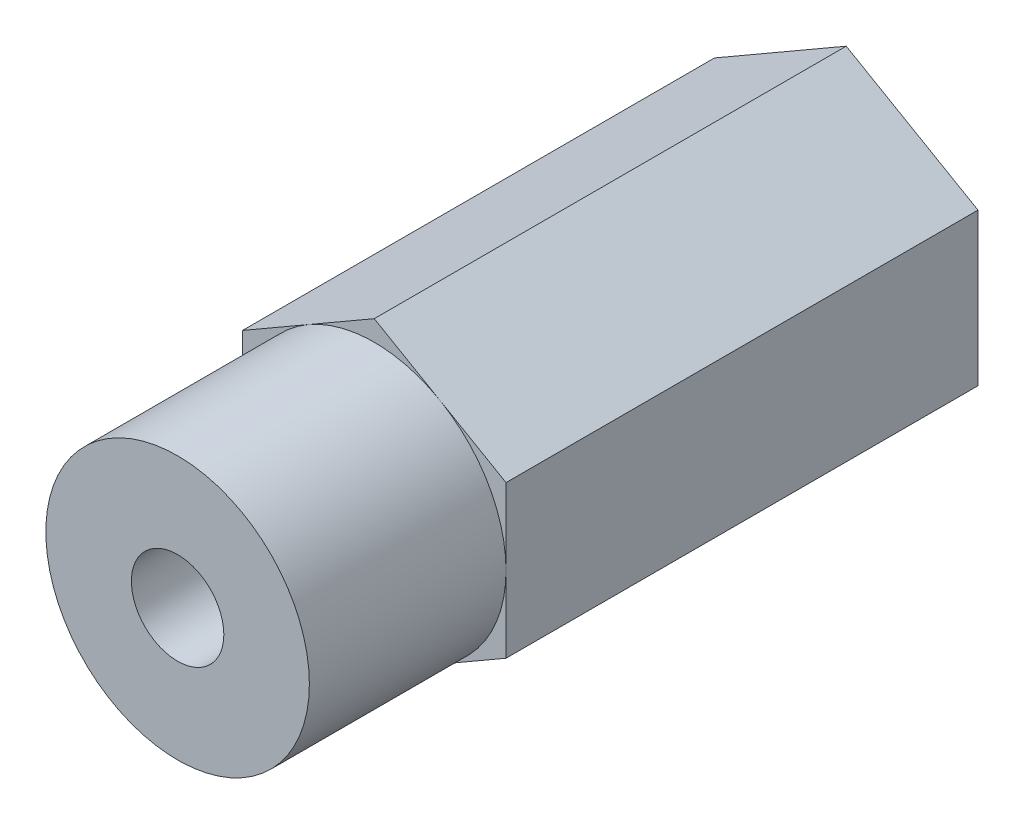
from build123d import *

# Parameters (mm, degrees)
BOSS_EXTRUDE1_DEPTH = 10.2
SKETCH2_R           = 2.320948082
SKETCH2_R_2         = 2.01
CUT_EXTRUDE2_DEPTH  = 3
SKETCH4_R           = 0.705
CUT_EXTRUDE3_DEPTH  = 7


with BuildPart() as part:
    # Sketch1 → Boss-Extrude1 (new body)
    with BuildSketch(Plane.XY):
        Polygon((0, -2.320948082), (2.01, -1.160474041), (2.01, 1.160474041), (0, 2.320948082), (-2.01, 1.160474041), (-2.01, -1.160474041), align=None)
    extrude(amount=BOSS_EXTRUDE1_DEPTH)

    # Sketch2 → Cut-Extrude2 (cut)
    with BuildSketch(Plane.XY.offset(10.2)):
        Circle(SKETCH2_R)
        Circle(SKETCH2_R_2, mode=Mode.SUBTRACT)
    extrude(amount=-CUT_EXTRUDE2_DEPTH, mode=Mode.SUBTRACT)

    # Sketch4 → Cut-Extrude3 (cut)
    with BuildSketch(Plane.XY.offset(10.2)):
        Circle(SKETCH4_R)
    extrude(amount=-CUT_EXTRUDE3_DEPTH, mode=Mode.SUBTRACT)


solid = part.part
